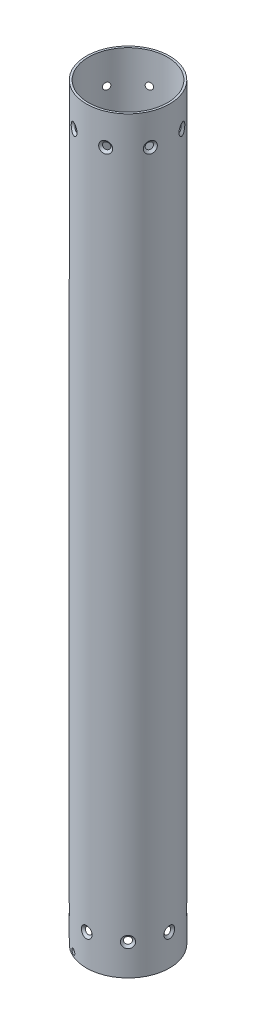
from build123d import *

# Parameters (mm, degrees)
SKETCH1_R                        = 25.4
SKETCH1_R_2                      = 24.1554
BODY_DEPTH                       = 457.2
BOTTOM_BOLT_PATTERN_COUNT        = 8
TOP_BOLT_PATTERN_COUNT           = 8
F_1_8_0_125_DIAMETER_HOLE1_D     = 3.175
F_1_8_0_125_DIAMETER_HOLE1_DEPTH = 12.7
F_1_8_0_125_DIAMETER_HOLE1_TIP   = 0.953866233


with BuildPart() as part:
    # Sketch1 → body (new body)
    with BuildSketch(Plane(origin=(0, 0, 0), x_dir=(1, 0, 0), z_dir=(0, 1, 0))):
        with Locations(Location((0, 0, 0), (0, 0, 270))):
            Circle(SKETCH1_R)
        with Locations(Location((0, 0, 0), (0, 0, 270))):
            Circle(SKETCH1_R_2, mode=Mode.SUBTRACT)
    extrude(amount=BODY_DEPTH)

    # Sketch2 → CSK for _6 Flat Head Machine Screw _100 (revolve, cut)
    with BuildSketch(Plane(origin=(25.4, 19.05, 0), x_dir=(0, 0, -1), z_dir=(0, 1, 0))):
        Polygon((0, 0), (0, 4.315824014), (1.89865, 3.175), (1.89865, 1.380025208), (3.5433, 0), align=None)
    csk_for_6_flat_head_machine_screw_100 = revolve(axis=Axis((31.75, 19.05, 0), (-1, 0, 0)), mode=Mode.SUBTRACT)

    # bottom-bolt-pattern: CSK for _6 Flat Head Machine Screw _100 ×8 about axis
    bottom_bolt_pattern_axis = Axis((0, 457.2, 0), (0, -1, 0))
    for i in range(1, BOTTOM_BOLT_PATTERN_COUNT):
        add(csk_for_6_flat_head_machine_screw_100.rotate(bottom_bolt_pattern_axis, i * 360 / BOTTOM_BOLT_PATTERN_COUNT), mode=Mode.SUBTRACT)

    # Sketch4 → CSK for _6 Flat Head Machine Screw _ 2 (revolve, cut)
    with BuildSketch(Plane(origin=(9.720159182, 438.15, -23.466540126), x_dir=(-0.9238795325112865, 0, -0.3826834323650906), z_dir=(0, 1, 0))):
        Polygon((0, 0), (0, 4.315824014), (1.89865, 3.175), (1.89865, 1.380025208), (3.5433, 0), align=None)
    csk_for_6_flat_head_machine_screw_2 = revolve(axis=Axis((12.150198978, 438.15, -29.333175157), (-0.38268343236509056, 0, 0.9238795325112865)), mode=Mode.SUBTRACT)

    # top-bolt-pattern: CSK for _6 Flat Head Machine Screw _ 2 ×8 about axis
    top_bolt_pattern_axis = Axis((0, 457.2, 0), (0, -1, 0))
    for i in range(1, TOP_BOLT_PATTERN_COUNT):
        add(csk_for_6_flat_head_machine_screw_2.rotate(top_bolt_pattern_axis, i * 360 / TOP_BOLT_PATTERN_COUNT), mode=Mode.SUBTRACT)

    # 1/8 (0.125) Diameter Hole1
    with Locations(Plane.XY.offset(25.4)):
        with Locations((-10.16, 2.54)):
            Hole(F_1_8_0_125_DIAMETER_HOLE1_D / 2, depth=F_1_8_0_125_DIAMETER_HOLE1_DEPTH)
            with Locations((0, 0, -(F_1_8_0_125_DIAMETER_HOLE1_DEPTH + F_1_8_0_125_DIAMETER_HOLE1_TIP / 2))):  # 118° drill point
                Cone(0, F_1_8_0_125_DIAMETER_HOLE1_D / 2, F_1_8_0_125_DIAMETER_HOLE1_TIP, mode=Mode.SUBTRACT)


solid = part.part
